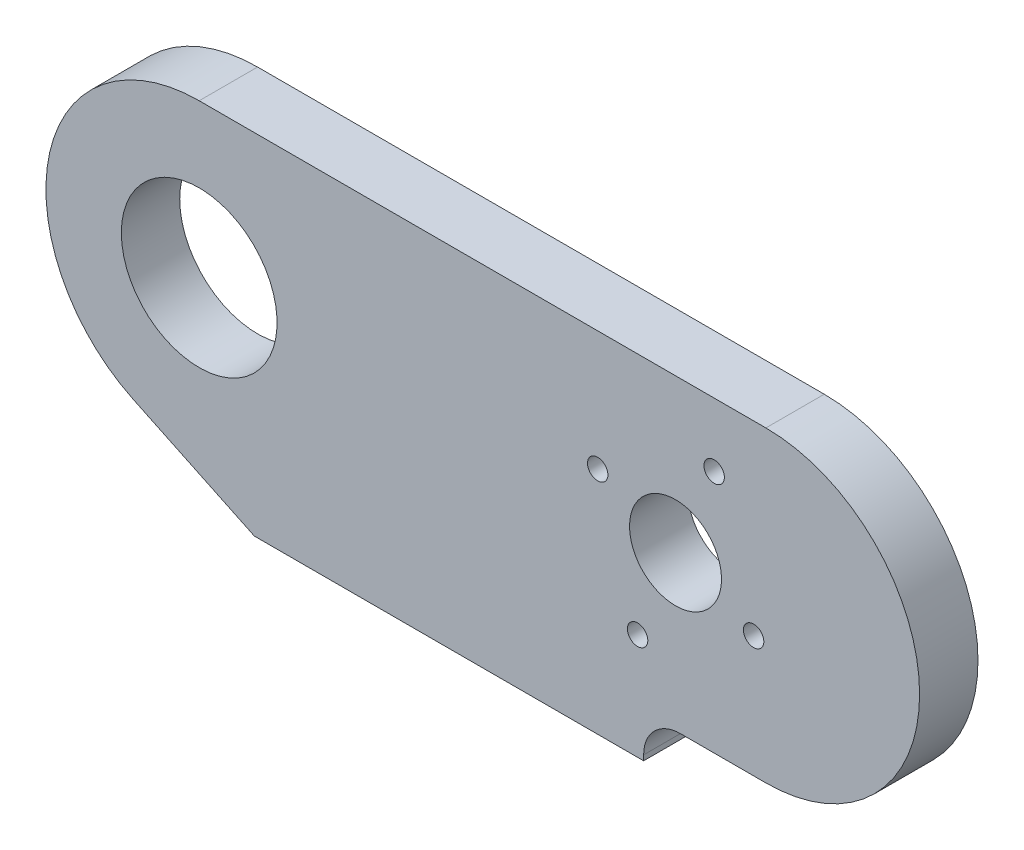
from build123d import *

# Parameters (mm, degrees)
SKETCH1_R           = 12.7
SKETCH1_R_2         = 7.5
BOSS_EXTRUDE1_DEPTH = 9.525
FILLET1_R           = 6
SKETCH6_R           = 1.665
CUT_EXTRUDE1_DEPTH  = 123.168257963


with BuildPart() as part:
    # Sketch1 → Boss-Extrude1 (new body)
    with BuildSketch(Plane.XY):
        with BuildLine():
            Line((9, -32), (72.5, -32))
            Line((72.5, -32), (72.5, -25.154302825))
            Line((72.5, -25.154302825), (79.665584639, -25.154302825))
            Line((79.665584639, -25.154302825), (92.440326559, -25.154302825))
            ThreePointArc((92.440326559, -25.154302825), (117.517477972, -0.077151413), (92.440326559, 25))
            Line((92.440326559, 25), (77.7, 25))
            Line((77.7, 25), (0, 25))
            ThreePointArc((0, 25), (-24.382533763, 5.521960459), (-10.771150987, -22.560636215))
            Line((-10.771150987, -22.560636215), (9, -32))
        make_face()
        with Locations(Location((0, 0, 0), (0, 0, 180))):
            Circle(SKETCH1_R, mode=Mode.SUBTRACT)
        with Locations(Location((77.7, 0, 0), (0, 0, 180))):
            Circle(SKETCH1_R_2, mode=Mode.SUBTRACT)
    extrude(amount=BOSS_EXTRUDE1_DEPTH)

    # Fillet1
    fillet1_edges = [part.edges().sort_by_distance(p)[0] for p in [
        (72.5, -25.154302825, 4.7625),
    ]]
    fillet(fillet1_edges, radius=FILLET1_R)

    # Sketch6 → Cut-Extrude1 (cut, through all)
    with BuildSketch(Plane.XY.offset(9.525)):
        with Locations((71.513283589, -14.673233797)):
            Circle(SKETCH6_R)
        with Locations((65.006745214, 5.474046027)):
            Circle(SKETCH6_R)
        with Locations((84.003798538, 14.623316108)):
            Circle(SKETCH6_R)
        with Locations((90.43821159, -5.368599676)):
            Circle(SKETCH6_R)
    extrude(amount=-CUT_EXTRUDE1_DEPTH, mode=Mode.SUBTRACT)


solid = part.part
